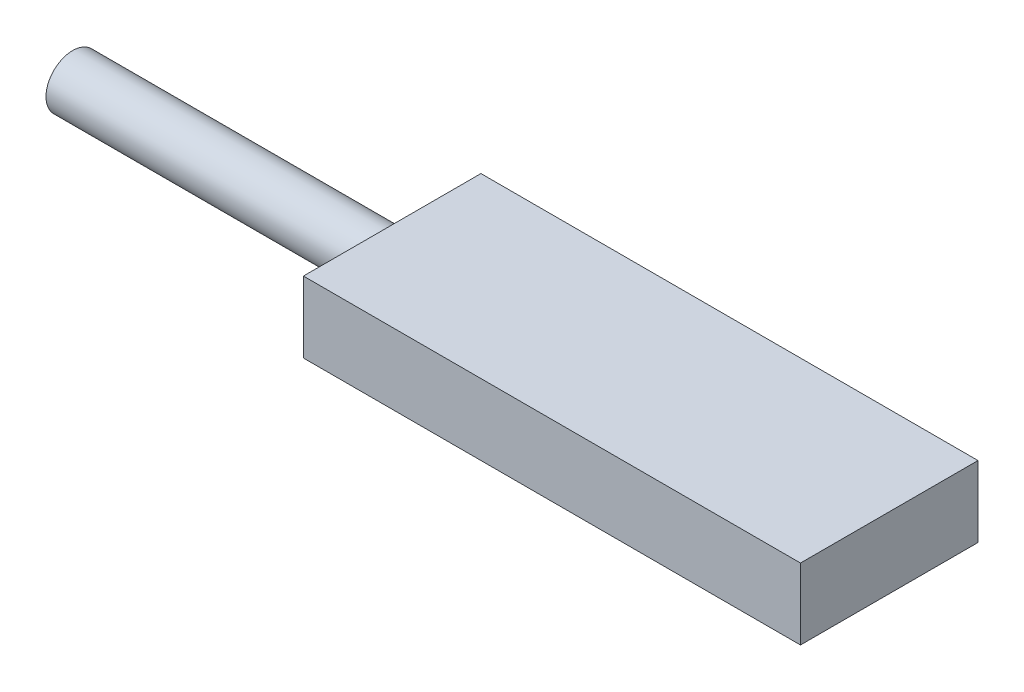
from build123d import *

# Parameters (mm, degrees)
SKETCH1_W           = 88.9
SKETCH1_H           = 31.75
BOSS_EXTRUDE1_DEPTH = 12.7
SKETCH2_R           = 4.7625
BOSS_EXTRUDE2_DEPTH = 57.15


with BuildPart() as part:
    # Sketch1 → Boss-Extrude1 (new body)
    with BuildSketch(Plane(origin=(0, 0, 0), x_dir=(1, 0, 0), z_dir=(0, 1, 0))):
        Rectangle(SKETCH1_W, SKETCH1_H)
    extrude(amount=BOSS_EXTRUDE1_DEPTH)

    # Sketch2 → Boss-Extrude2 (add)
    with BuildSketch(Plane.ZY.offset(44.45)):
        with Locations((0, 6.35)):
            Circle(SKETCH2_R)
    extrude(amount=BOSS_EXTRUDE2_DEPTH)


solid = part.part
